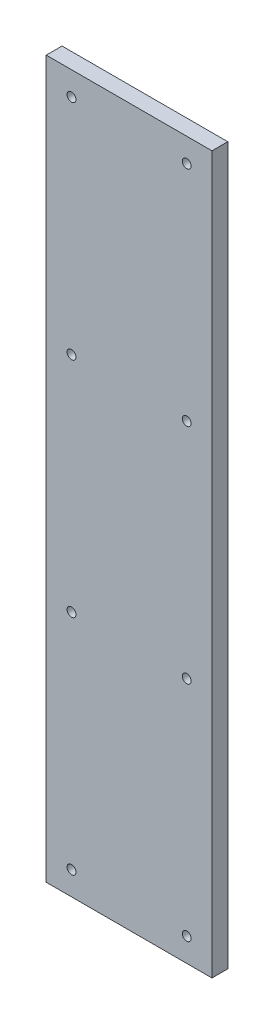
from build123d import *

# Parameters (mm, degrees)
SKETCH2_W           = 66.7
SKETCH2_H           = 288.29
SKETCH2_R           = 1.7859375
BOSS_EXTRUDE2_DEPTH = 6.35


with BuildPart() as part:
    # Sketch2 → Boss-Extrude2 (new body)
    with BuildSketch(Plane.XY):
        with Locations((33.35, -144.145)):
            Rectangle(SKETCH2_W, SKETCH2_H)
        with Locations((10.175, -9.525)):
            Circle(SKETCH2_R, mode=Mode.SUBTRACT)
        with Locations((56.525, -9.525)):
            Circle(SKETCH2_R, mode=Mode.SUBTRACT)
        with Locations((56.525, -99.271666667)):
            Circle(SKETCH2_R, mode=Mode.SUBTRACT)
        with Locations((10.175, -99.271666667)):
            Circle(SKETCH2_R, mode=Mode.SUBTRACT)
        with Locations((10.175, -278.765)):
            Circle(SKETCH2_R, mode=Mode.SUBTRACT)
        with Locations((56.525, -278.765)):
            Circle(SKETCH2_R, mode=Mode.SUBTRACT)
        with Locations((10.175, -189.018333333)):
            Circle(SKETCH2_R, mode=Mode.SUBTRACT)
        with Locations((56.525, -189.018333333)):
            Circle(SKETCH2_R, mode=Mode.SUBTRACT)
    extrude(amount=BOSS_EXTRUDE2_DEPTH)


solid = part.part
